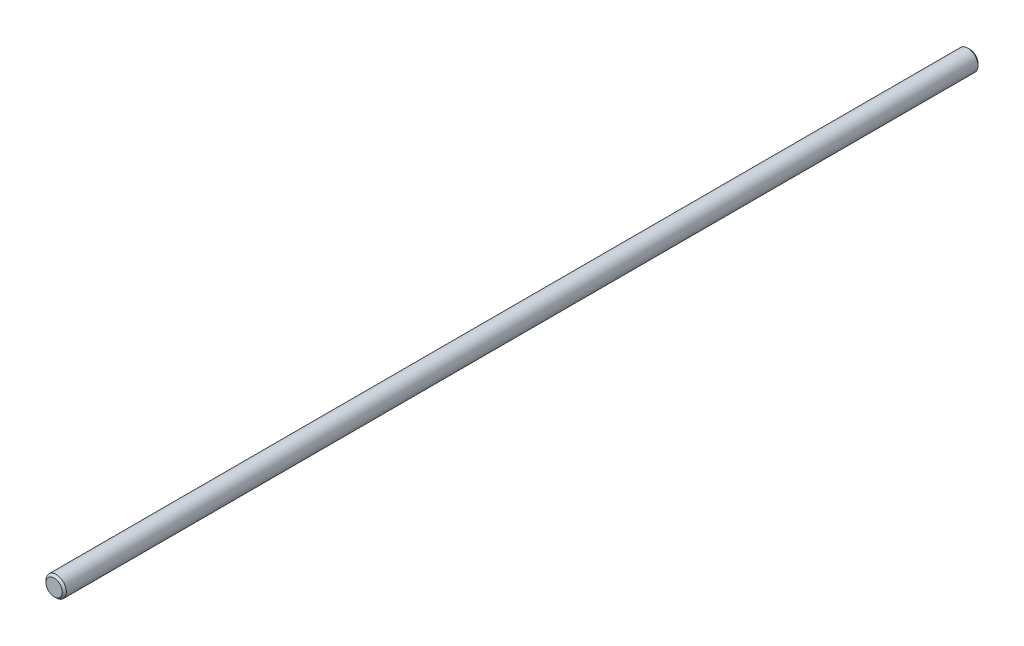
from build123d import *

# Parameters (mm, degrees)
SKETCH1_R           = 1
BOSS_EXTRUDE1_DEPTH = 90
CHAMFER1_SIZE       = 0.2


with BuildPart() as part:
    # Sketch1 → Boss-Extrude1 (new body)
    with BuildSketch(Plane.XY):
        with Locations(Location((0, 0, 0), (0, 0, 180))):
            Circle(SKETCH1_R)
    extrude(amount=BOSS_EXTRUDE1_DEPTH)

    # Chamfer1
    chamfer1_edges = [part.edges().sort_by_distance(p)[0] for p in [
        (1, 0, 0),
        (1, 0, 90),
    ]]
    chamfer(chamfer1_edges, length=CHAMFER1_SIZE)


solid = part.part
